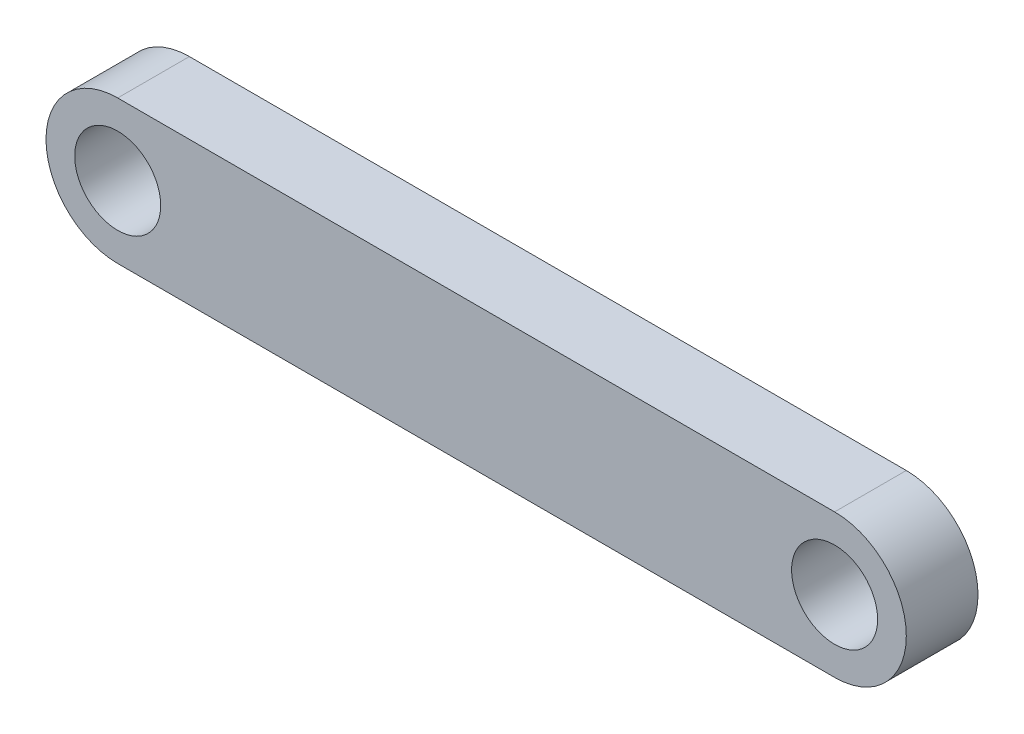
from build123d import *

# Parameters (mm, degrees)
SKETCH1_R           = 3
BOSS_EXTRUDE1_DEPTH = 5


with BuildPart() as part:
    # Sketch1 → Boss-Extrude1 (new body)
    with BuildSketch(Plane.XY):
        with BuildLine():
            Line((25, -5), (-25, -5))
            ThreePointArc((-25, -5), (-30, 0), (-25, 5))
            Line((-25, 5), (25, 5))
            ThreePointArc((25, 5), (30, 0), (25, -5))
        make_face()
        with Locations((-25, 0)):
            Circle(SKETCH1_R, mode=Mode.SUBTRACT)
        with Locations((25, 0)):
            Circle(SKETCH1_R, mode=Mode.SUBTRACT)
    extrude(amount=BOSS_EXTRUDE1_DEPTH)


solid = part.part
